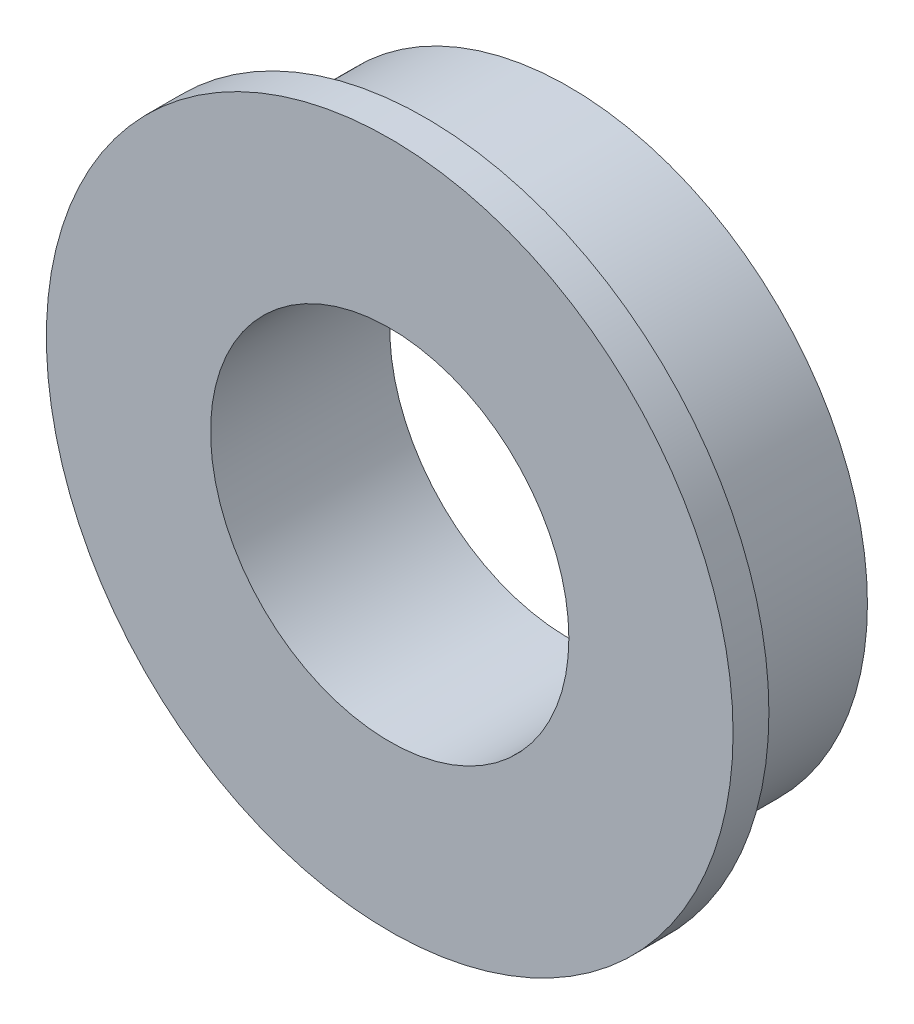
from build123d import *


with BuildPart() as part:
    # ｽｹｯﾁ1 → 回転1 (revolve)
    with BuildSketch(Plane(origin=(0, 0, 0), x_dir=(0, 0, -1), z_dir=(1, 0, 0)), mode=Mode.PRIVATE) as revolve_1_sk:
        Polygon((-0.6, 5.75), (-0.6, 3), (2.4, 3), (2.4, 5), (0, 5), (0, 5.75), align=None)
    revolve(revolve_1_sk.sketch.rotate(Axis((0, 0, 0), (0, 0, -1)), 90), axis=Axis((0, 0, 0), (0, 0, -1)))


solid = part.part
